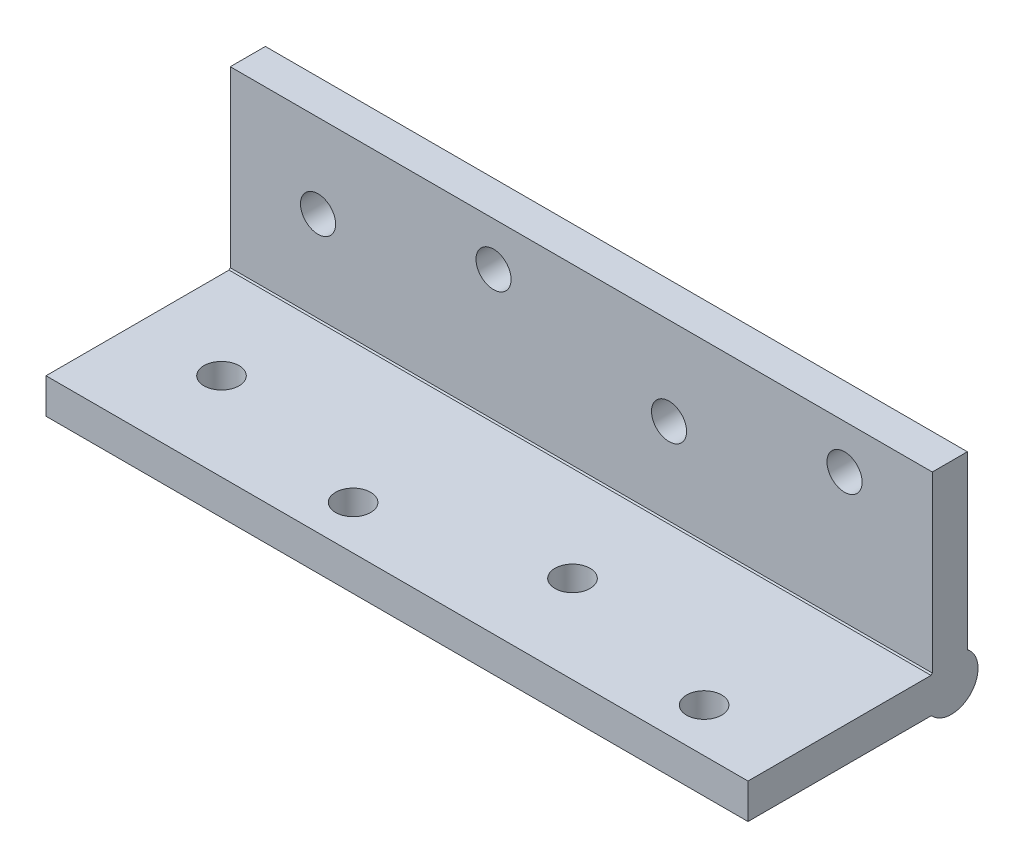
from build123d import *

# Parameters (mm, degrees)
SKETCH1_W           = 80
SKETCH1_H           = 25
BOSS_EXTRUDE1_DEPTH = 4
SKETCH2_W           = 80
SKETCH2_H           = 4
BOSS_EXTRUDE2_DEPTH = 20
SKETCH3_R           = 3.042773103
BOSS_EXTRUDE3_DEPTH = 80
SKETCH4_R           = 2
CUT_EXTRUDE1_DEPTH  = 80
SKETCH5_R           = 2
CUT_EXTRUDE2_DEPTH  = 80


with BuildPart() as part:
    # Sketch1 → Boss-Extrude1 (new body)
    with BuildSketch(Plane(origin=(0, 0, 0), x_dir=(1, 0, 0), z_dir=(0, 1, 0))):
        Rectangle(SKETCH1_W, SKETCH1_H)
    extrude(amount=BOSS_EXTRUDE1_DEPTH)

    # Sketch2 → Boss-Extrude2 (add)
    with BuildSketch(Plane(origin=(0, 4, 0), x_dir=(1, 0, 0), z_dir=(0, 1, 0))):
        with Locations((0, 10.5)):
            Rectangle(SKETCH2_W, SKETCH2_H)
    extrude(amount=BOSS_EXTRUDE2_DEPTH)

    # Sketch3 → Boss-Extrude3 (add)
    with BuildSketch(Plane.ZY.offset(40)):
        with Locations((-10.673404756, 2.028198383)):
            Circle(SKETCH3_R)
    extrude(amount=-BOSS_EXTRUDE3_DEPTH)

    # Sketch4 → Cut-Extrude1 (cut)
    with BuildSketch(Plane(origin=(0, 0, -12.5), x_dir=(-1, 0, 0), z_dir=(0, 0, -1))):
        with Locations((30, 14.461718051)):
            Circle(SKETCH4_R)
        with Locations((-10, 14)):
            Circle(SKETCH4_R)
        with Locations((10, 19)):
            Circle(SKETCH4_R)
        with Locations((-30, 19)):
            Circle(SKETCH4_R)
    extrude(amount=-CUT_EXTRUDE1_DEPTH, mode=Mode.SUBTRACT)

    # Sketch5 → Cut-Extrude2 (cut)
    with BuildSketch(Plane.XZ):
        with Locations(Location((-30, 2.5, 0), (0, 0, 270))):
            Circle(SKETCH5_R)
        with Locations(Location((-10, 7.5, 0), (0, 0, 270))):
            Circle(SKETCH5_R)
        with Locations(Location((10, 2.5, 0), (0, 0, 270))):
            Circle(SKETCH5_R)
        with Locations(Location((30, 7.5, 0), (0, 0, 270))):
            Circle(SKETCH5_R)
    extrude(amount=-CUT_EXTRUDE2_DEPTH, mode=Mode.SUBTRACT)


solid = part.part
